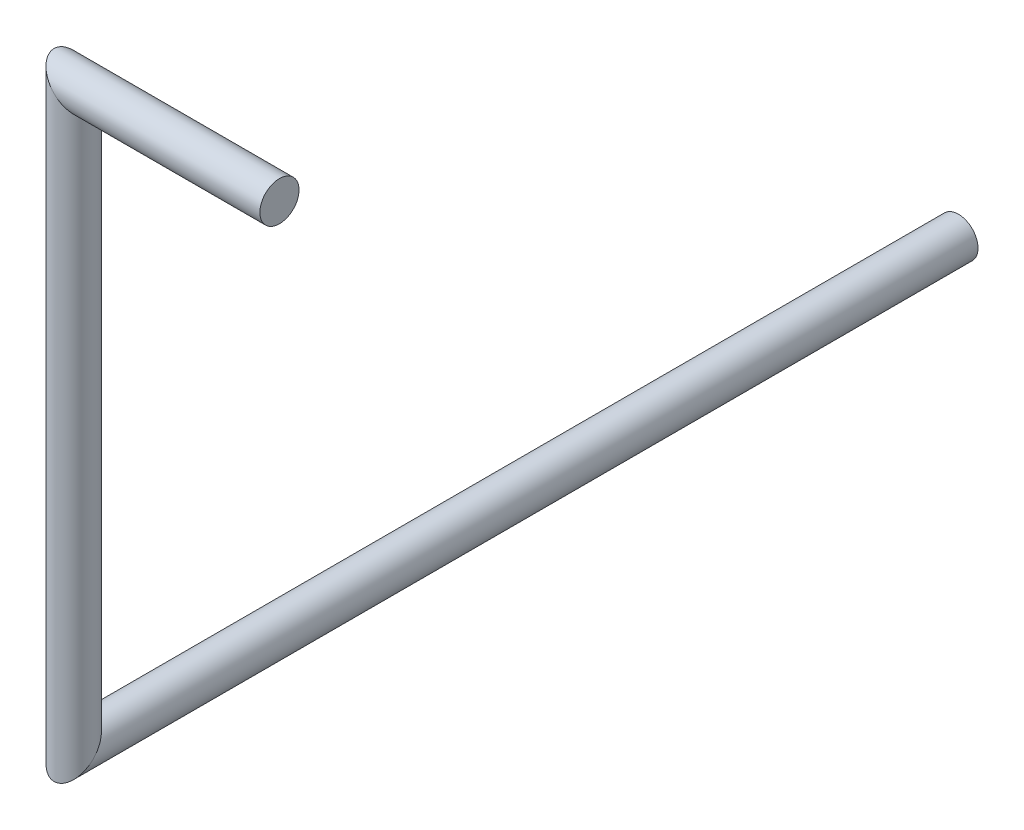
from build123d import *

# Parameters (mm, degrees)
CROQUIS1_R              = 9.525
SALIENTE_EXTRUIR1_DEPTH = 10
CROQUIS2_R              = 9.525


with BuildPart() as part:
    # Croquis1 → Saliente-Extruir1 (new body)
    with BuildSketch(Plane.XY):
        Circle(CROQUIS1_R)
    extrude(amount=SALIENTE_EXTRUIR1_DEPTH)

    # Barrer1: sweep along a curve in space
    with BuildLine() as barrer1_path:
        Line((0, 0, 10), (0, 0, 430))
        Line((0, 0, 430), (0, 280, 430))
        Line((0, 280, 430), (100, 280, 430))
    # Croquis2 → Barrer1 (sweep)
    with BuildSketch(Plane.XY.offset(10)):
        Circle(CROQUIS2_R)
    sweep(path=barrer1_path.line, transition=Transition.RIGHT)


solid = part.part
